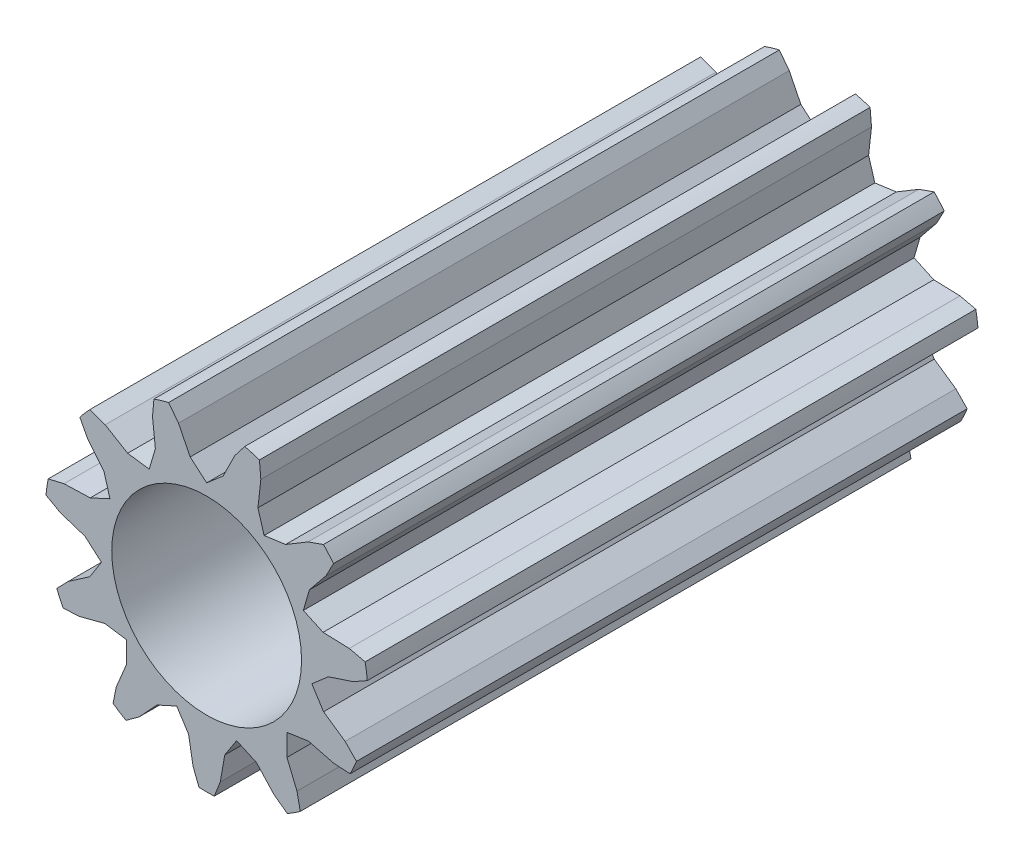
from build123d import *

# Parameters (mm, degrees)
SKETCH1_R               = 9.7778
BOSS_EXTRUDE1_DEPTH     = 37
CUT_EXTRUDE1_DEPTH      = 40.499503107
CUT_EXTRUDE2_DEPTH      = 40.499503107
CUT_EXTRUDE2_DEPTH_BACK = 40.499503107
SKETCH4_R               = 5.75
CIRPATTERN1_COUNT       = 11


with BuildPart() as part:
    # Sketch1 → Boss-Extrude1 (new body)
    with BuildSketch(Plane.XY):
        Circle(SKETCH1_R)
    extrude(amount=BOSS_EXTRUDE1_DEPTH)

    # Sketch2 → Cut-Extrude1 (cut, through all)
    with BuildSketch(Plane.XY):
        Polygon((0, 6.440231992), (-0.998470792, 7.29965938), (-1.704297747, 8.720724317), (-2.306603416, 9.501839481), (-1.704297747, 10.285038999), (0, 10.999278518), (1.704297747, 10.285038999), (2.306603416, 9.501839481), (1.704297747, 8.720724317), (0.998470792, 7.29965938), align=None)
    cut_extrude1 = extrude(amount=CUT_EXTRUDE1_DEPTH, mode=Mode.SUBTRACT)

    # Sketch4 → Cut-Extrude2 (cut, two sides: drawn at the far end of the back side and taken through both)
    with BuildSketch(Plane.XY.offset(37).offset(-CUT_EXTRUDE2_DEPTH_BACK)):
        Circle(SKETCH4_R)
    extrude(amount=CUT_EXTRUDE2_DEPTH + CUT_EXTRUDE2_DEPTH_BACK, mode=Mode.SUBTRACT)

    # CirPattern1: Cut-Extrude1 ×11 about axis
    cirpattern1_axis = Axis((0, 0, 0), (0, 0, 1))
    for i in range(1, CIRPATTERN1_COUNT):
        add(cut_extrude1.rotate(cirpattern1_axis, i * 360 / CIRPATTERN1_COUNT), mode=Mode.SUBTRACT)


solid = part.part
